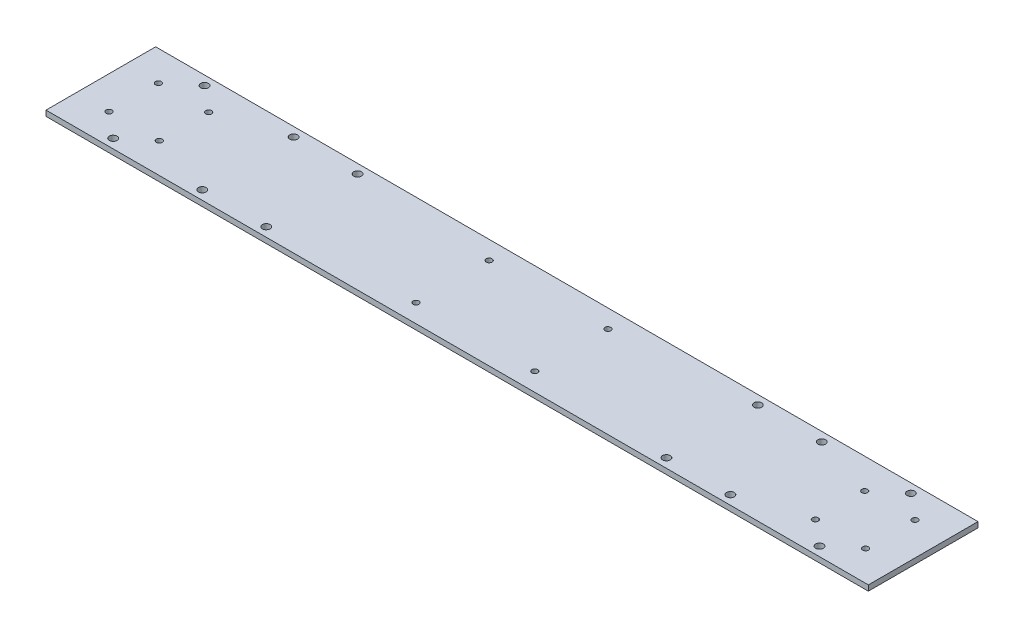
from build123d import *

# Parameters (mm, degrees)
SKETCH_1_W             = 450
SKETCH_1_H             = 60
EXTRUDE_1_DEPTH        = 3
SKETCH_2_R             = 1.6
SKETCH_2_R_2           = 2.1
CUT_EXTRUDE_1_DEPTH    = 267.924326413
SKETCH_3_R             = 1.6
CUT_EXTRUDE_1724_DEPTH = 10


with BuildPart() as part:
    # 草图1 → 凸台-拉伸1 (new body)
    with BuildSketch(Plane(origin=(0, 0, 0), x_dir=(1, 0, 0), z_dir=(0, 1, 0))):
        with Locations((-21.441364286, 72.5)):
            Rectangle(SKETCH_1_W, SKETCH_1_H)
    extrude(amount=EXTRUDE_1_DEPTH)

    # 草图2 → 切除-拉伸1 (cut, through all)
    with BuildSketch(Plane(origin=(0, 3, 0), x_dir=(1, 0, 0), z_dir=(0, 1, 0))):
        with Locations(Location((-228.441364286, 86, 0), (0, 0, 270))):
            Circle(SKETCH_2_R)
        with Locations(Location((-228.441364286, 59, 0), (0, 0, 270))):
            Circle(SKETCH_2_R)
        with Locations(Location((-200.941364286, 86, 0), (0, 0, 270))):
            Circle(SKETCH_2_R)
        with Locations(Location((-200.941364286, 59, 0), (0, 0, 90))):
            Circle(SKETCH_2_R)
        with Locations(Location((-130.941364286, 97.5, 0), (0, 0, 270))):
            Circle(SKETCH_2_R_2)
        with Locations(Location((-165.941364286, 97.5, 0), (0, 0, 270))):
            Circle(SKETCH_2_R_2)
        with Locations(Location((-130.941364286, 47.5, 0), (0, 0, 90))):
            Circle(SKETCH_2_R_2)
        with Locations(Location((-165.941364286, 47.5, 0), (0, 0, 90))):
            Circle(SKETCH_2_R_2)
        with Locations(Location((-214.691364286, 97.5, 0), (0, 0, 270))):
            Circle(SKETCH_2_R_2)
        with Locations(Location((-214.691364286, 47.5, 0), (0, 0, 90))):
            Circle(SKETCH_2_R_2)
        with Locations(Location((158.058635714, 86, 0), (0, 0, 90))):
            Circle(SKETCH_2_R)
        with Locations(Location((171.808635714, 47.5, 0), (0, 0, 270))):
            Circle(SKETCH_2_R_2)
        with Locations(Location((185.558635714, 59, 0), (0, 0, 90))):
            Circle(SKETCH_2_R)
        with Locations(Location((158.058635714, 59, 0), (0, 0, 270))):
            Circle(SKETCH_2_R)
        with Locations(Location((123.058635714, 47.5, 0), (0, 0, 270))):
            Circle(SKETCH_2_R_2)
        with Locations(Location((88.058635714, 47.5, 0), (0, 0, 270))):
            Circle(SKETCH_2_R_2)
        with Locations(Location((88.058635714, 97.5, 0), (0, 0, 90))):
            Circle(SKETCH_2_R_2)
        with Locations(Location((123.058635714, 97.5, 0), (0, 0, 90))):
            Circle(SKETCH_2_R_2)
        with Locations(Location((171.808635714, 97.5, 0), (0, 0, 90))):
            Circle(SKETCH_2_R_2)
        with Locations(Location((185.558635714, 86, 0), (0, 0, 90))):
            Circle(SKETCH_2_R)
    extrude(amount=-CUT_EXTRUDE_1_DEPTH, mode=Mode.SUBTRACT)

    # 草图3 → Cut-Extrude 1724 (cut)
    with BuildSketch(Plane(origin=(0, 3, 0), x_dir=(1, 0, 0), z_dir=(0, 1, 0))):
        with Locations(Location((-53.941364286, 92.5, 0), (0, 0, 270))):
            Circle(SKETCH_3_R)
        with Locations(Location((11.058635714, 92.5, 0), (0, 0, 270))):
            Circle(SKETCH_3_R)
        with Locations(Location((11.058635714, 52.5, 0), (0, 0, 270))):
            Circle(SKETCH_3_R)
        with Locations(Location((-53.941364286, 52.5, 0), (0, 0, 270))):
            Circle(SKETCH_3_R)
    extrude(amount=-CUT_EXTRUDE_1724_DEPTH, mode=Mode.SUBTRACT)


solid = part.part
